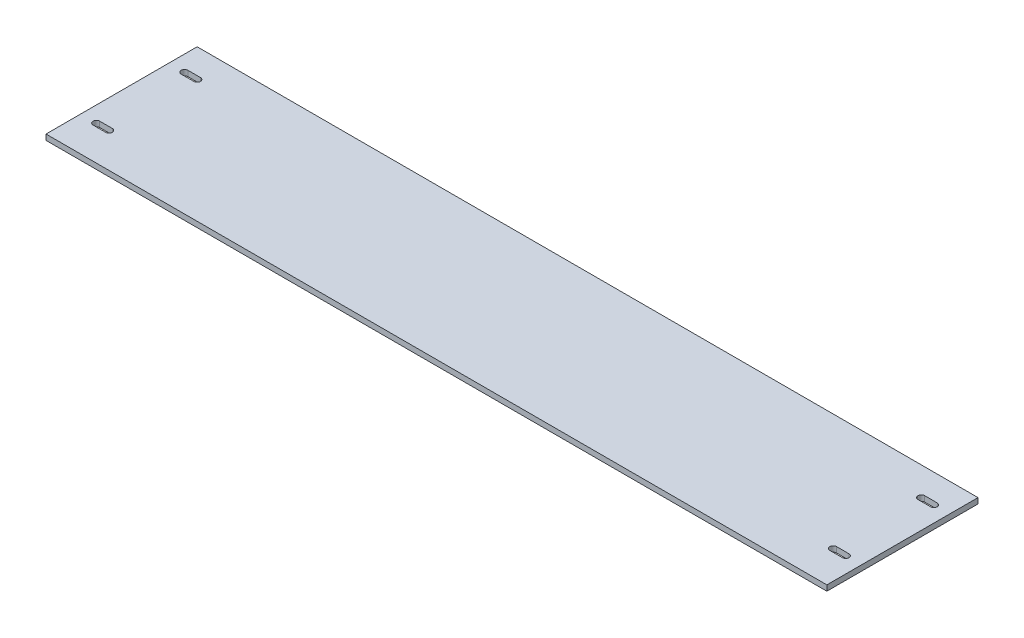
from build123d import *

# Parameters (mm, degrees)
SKETCH1_W           = 787.4
SKETCH1_H           = 152.4
BOSS_EXTRUDE1_DEPTH = 5.588


with BuildPart() as part:
    # Sketch1 → Boss-Extrude1 (new body)
    with BuildSketch(Plane(origin=(0, 0, 0), x_dir=(1, 0, 0), z_dir=(0, 1, 0))):
        with Locations((393.7, 76.2)):
            Rectangle(SKETCH1_W, SKETCH1_H)
        with BuildLine():
            Line((15.875, 38.3032), (28.575, 38.3032))
            ThreePointArc((28.575, 38.3032), (31.9532, 34.925), (28.575, 31.5468))
            Line((28.575, 31.5468), (15.875, 31.5468))
            ThreePointArc((15.875, 31.5468), (12.4968, 34.925), (15.875, 38.3032))
        make_face(mode=Mode.SUBTRACT)
        with BuildLine():
            Line((15.875, 127.2032), (28.575, 127.2032))
            ThreePointArc((28.575, 127.2032), (31.9532, 123.825), (28.575, 120.4468))
            Line((28.575, 120.4468), (15.875, 120.4468))
            ThreePointArc((15.875, 120.4468), (12.4968, 123.825), (15.875, 127.2032))
        make_face(mode=Mode.SUBTRACT)
        with BuildLine():
            Line((771.525, 120.4468), (758.825, 120.4468))
            ThreePointArc((758.825, 120.4468), (755.4468, 123.825), (758.825, 127.2032))
            Line((758.825, 127.2032), (771.525, 127.2032))
            ThreePointArc((771.525, 127.2032), (774.9032, 123.825), (771.525, 120.4468))
        make_face(mode=Mode.SUBTRACT)
        with BuildLine():
            Line((771.525, 31.5468), (758.825, 31.5468))
            ThreePointArc((758.825, 31.5468), (755.4468, 34.925), (758.825, 38.3032))
            Line((758.825, 38.3032), (771.525, 38.3032))
            ThreePointArc((771.525, 38.3032), (774.9032, 34.925), (771.525, 31.5468))
        make_face(mode=Mode.SUBTRACT)
    extrude(amount=BOSS_EXTRUDE1_DEPTH)


solid = part.part
